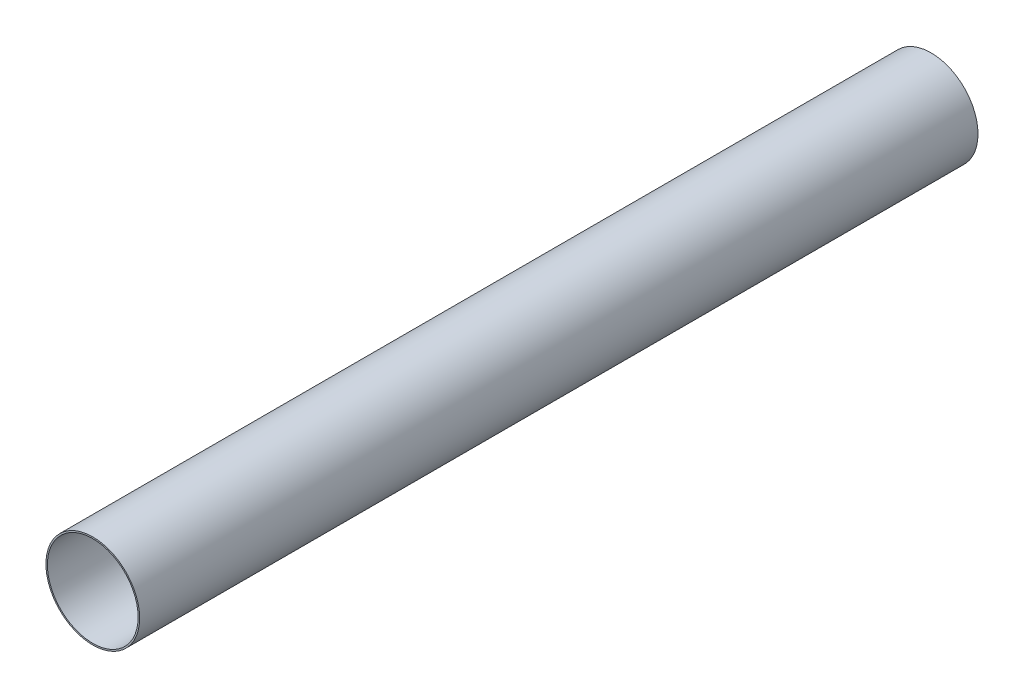
from build123d import *

# Parameters (mm, degrees)
SKETCH1_R           = 38
SKETCH1_R_2         = 36.8
BOSS_EXTRUDE1_DEPTH = 680


with BuildPart() as part:
    # Sketch1 → Boss-Extrude1 (new body)
    with BuildSketch(Plane.XY):
        Circle(SKETCH1_R)
        Circle(SKETCH1_R_2, mode=Mode.SUBTRACT)
    extrude(amount=BOSS_EXTRUDE1_DEPTH)


solid = part.part
